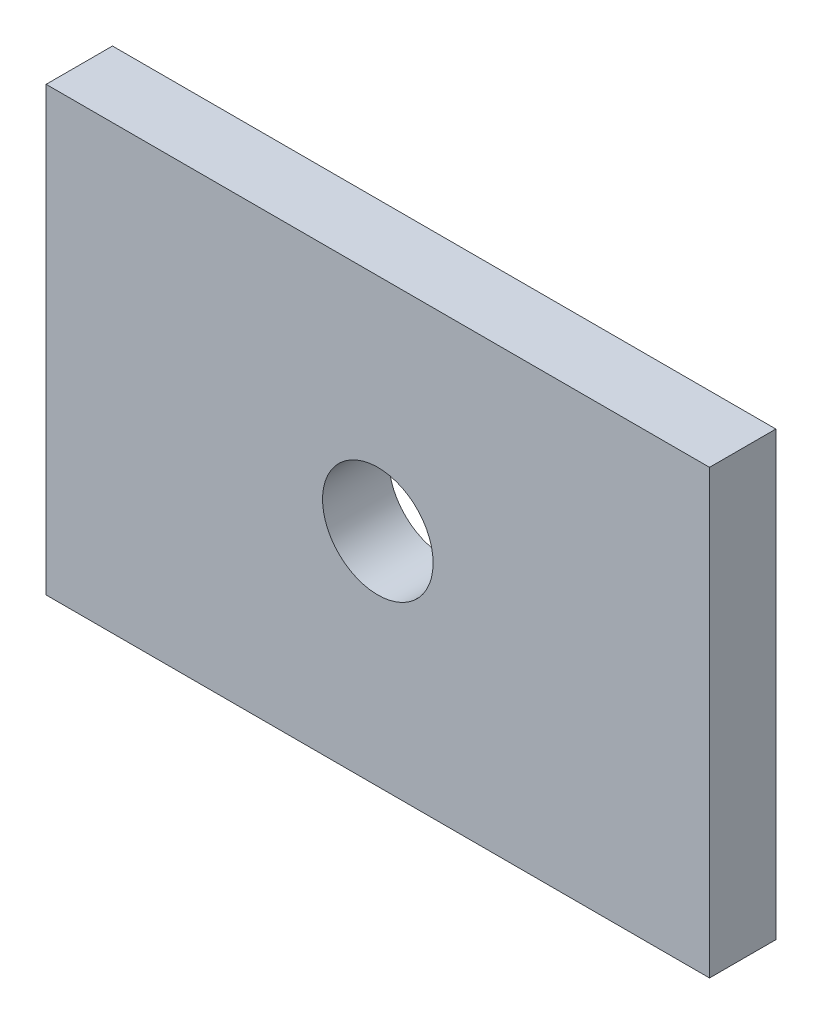
from build123d import *

# Parameters (mm, degrees)
SKETCH1_W           = 30
SKETCH1_H           = 20
BOSS_EXTRUDE2_DEPTH = 3
SKETCH6_R           = 2.5
CUT_EXTRUDE1_DEPTH  = 3


with BuildPart() as part:
    # Sketch1 → Boss-Extrude2 (new body)
    with BuildSketch(Plane.XY):
        with Locations((-11.265613609, 58.237424058)):
            Rectangle(SKETCH1_W, SKETCH1_H)
    extrude(amount=BOSS_EXTRUDE2_DEPTH)

    # Sketch6 → Cut-Extrude1 (cut)
    with BuildSketch(Plane.XY.offset(3)):
        with Locations((-11.265613609, 58.237424058)):
            Circle(SKETCH6_R)
    extrude(amount=-CUT_EXTRUDE1_DEPTH, mode=Mode.SUBTRACT)


solid = part.part
